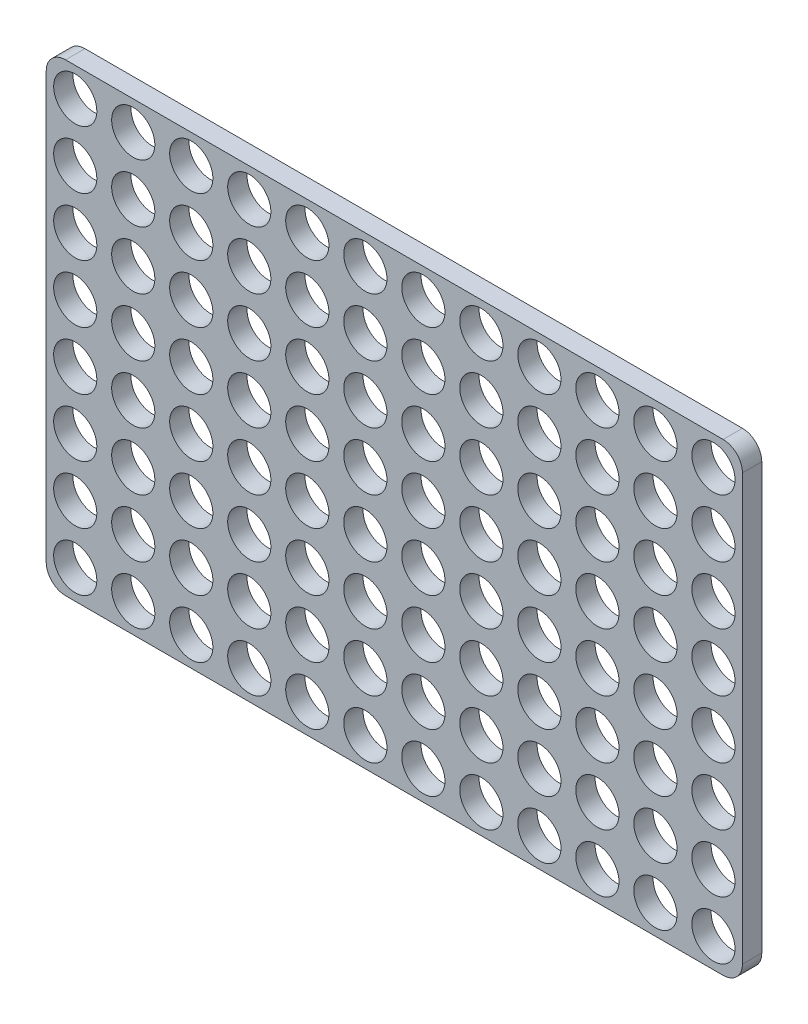
from build123d import *

# Parameters (mm, degrees)
SKIZZE1_W                       = 9
SKIZZE1_H                       = 9
SKIZZE1_R                       = 3.35
AUFSATZ_LINEAR_AUSTRAGEN1_DEPTH = 3
LINEARES_MUSTER1_COUNT          = 12
LINEARES_MUSTER1_PITCH          = 9
LINEARES_MUSTER1_COUNT_DIR2     = 8
LINEARES_MUSTER1_PITCH_DIR2     = 9
VERRUNDUNG1_R                   = 3


with BuildPart() as part:
    # Skizze1 → Aufsatz-Linear austragen1 (new body)
    with BuildSketch(Plane.XY):
        with Locations((4.5, 4.5)):
            Rectangle(SKIZZE1_W, SKIZZE1_H)
        with Locations((4.5, 4.5)):
            Circle(SKIZZE1_R, mode=Mode.SUBTRACT)
    aufsatz_linear_austragen1 = extrude(amount=AUFSATZ_LINEAR_AUSTRAGEN1_DEPTH)

    # Lineares Muster1: Aufsatz-Linear austragen1 12 × 8
    with Locations(*[(i * LINEARES_MUSTER1_PITCH, j * LINEARES_MUSTER1_PITCH_DIR2, 0) for i in range(LINEARES_MUSTER1_COUNT) for j in range(LINEARES_MUSTER1_COUNT_DIR2) if (i, j) != (0, 0)]):
        add(aufsatz_linear_austragen1)

    # Verrundung1
    verrundung1_edges = [part.edges().sort_by_distance(p)[0] for p in [
        (0, 72, 1.5),
        (108, 72, 1.5),
        (108, 0, 1.5),
        (0, 0, 1.5),
    ]]
    fillet(verrundung1_edges, radius=VERRUNDUNG1_R)


solid = part.part
